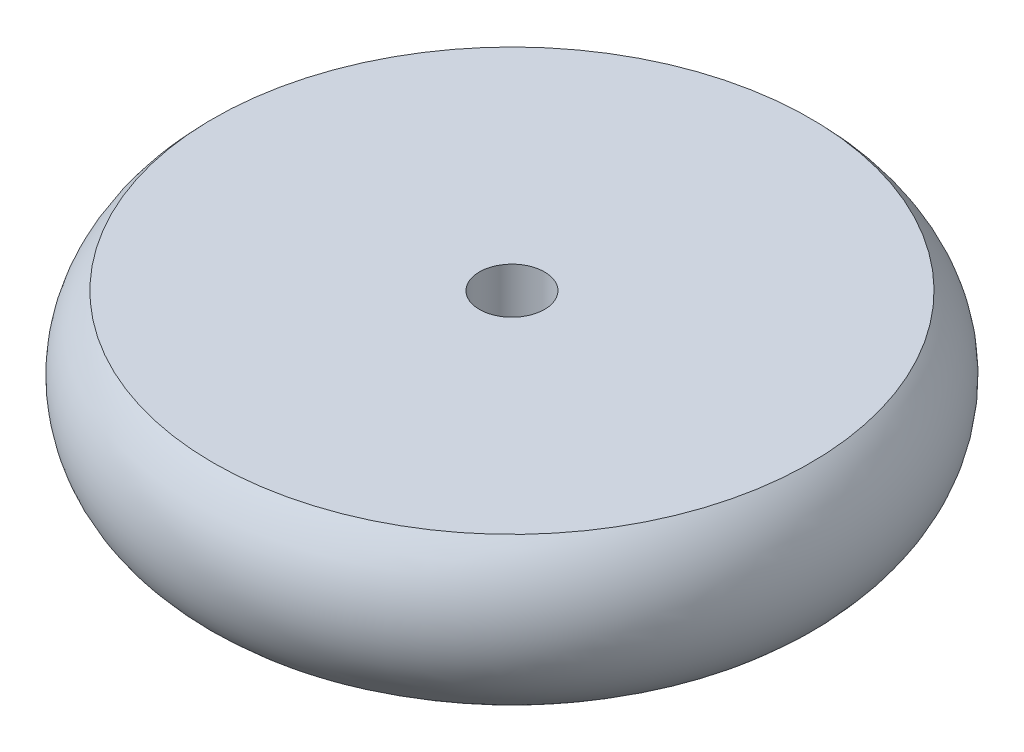
from build123d import *


with BuildPart() as part:
    # Esquisse1 → Révolution1 (revolve)
    with BuildSketch(Plane.XY, mode=Mode.PRIVATE) as r_volution1_sk:
        with BuildLine():
            Line((36.674675786, 9), (4, 9))
            Line((4, 9), (4, -12.5))
            Line((4, -12.5), (28, -12.5))
            ThreePointArc((28, -12.5), (39.592023119, -4.677071733), (36.674675786, 9))
        make_face()
    revolve(r_volution1_sk.sketch.rotate(Axis((0, 26.236692696, 0), (0, -1, 0)), 90), axis=Axis((0, 26.236692696, 0), (0, -1, 0)))


solid = part.part
